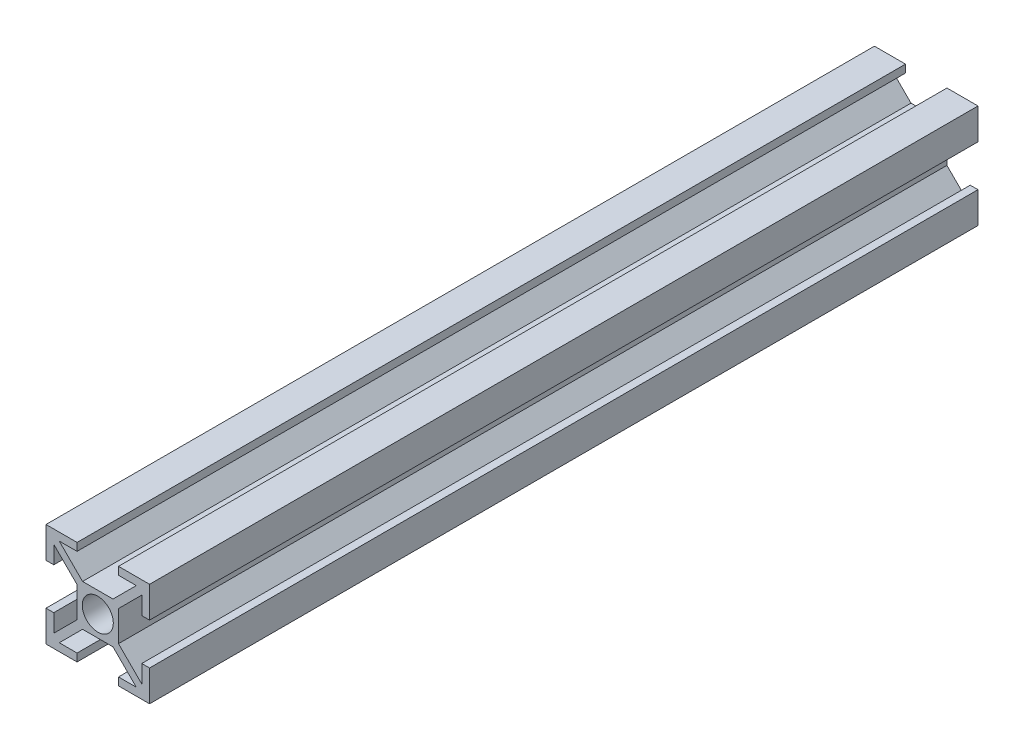
from build123d import *

# Parameters (mm, degrees)
ESBO_O1_R                = 3
RESSALTO_EXTRUS_O1_DEPTH = 160


with BuildPart() as part:
    # Esboço1 → Ressalto-extrusão1 (new body)
    with BuildSketch(Plane.XY):
        Polygon((-2.939339828, 4), (2.939339828, 4), (7.439339828, 8.5), (4, 8.5), (4, 10), (10, 10), (10, 4), (8.5, 4), (8.5, 7.439339828), (4, 2.939339828), (4, -2.939339828), (8.5, -7.439339828), (8.5, -4), (10, -4), (10, -10), (4, -10), (4, -8.5), (7.439339828, -8.5), (2.939339828, -4), (-2.939339828, -4), (-7.439339828, -8.5), (-4, -8.5), (-4, -10), (-10, -10), (-10, -4), (-8.5, -4), (-8.5, -7.439339828), (-4, -2.939339828), (-4, 2.939339828), (-8.5, 7.439339828), (-8.5, 4), (-10, 4), (-10, 10), (-4, 10), (-4, 8.5), (-7.439339828, 8.5), align=None)
        Circle(ESBO_O1_R, mode=Mode.SUBTRACT)
    extrude(amount=RESSALTO_EXTRUS_O1_DEPTH)


solid = part.part
